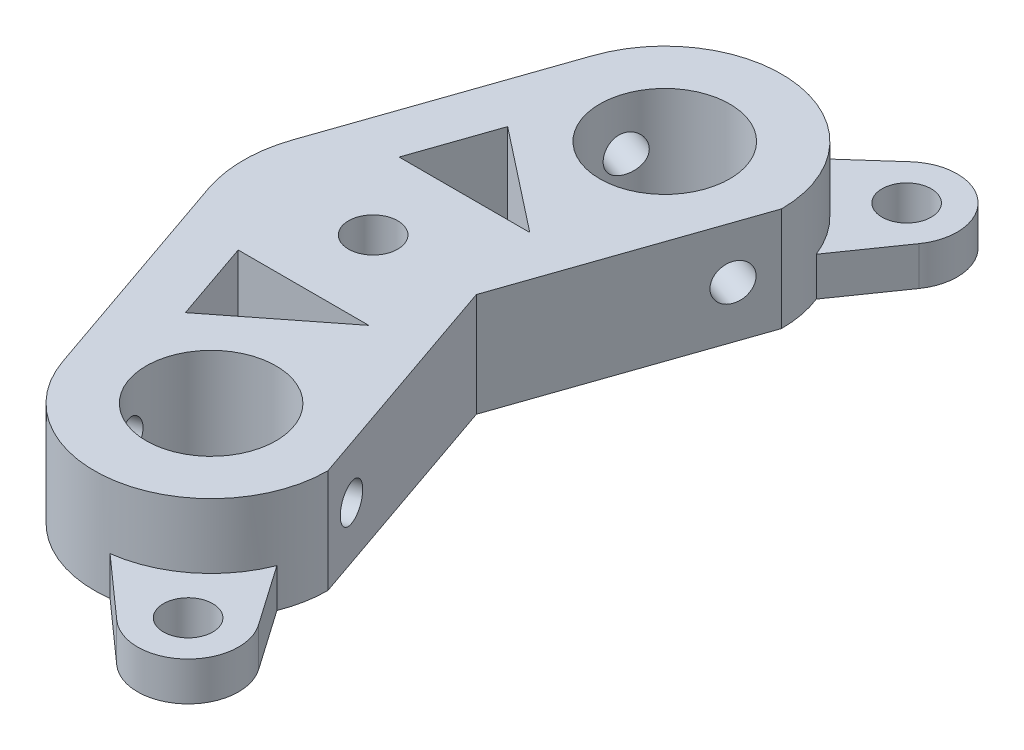
from build123d import *

# Parameters (mm, degrees)
SKETCH1_R               = 1.9
SKETCH1_R_2             = 5.01
BOSS_EXTRUDE1_DEPTH     = 8
SKETCH2_R               = 1.9
BOSS_EXTRUDE2_DEPTH     = 3
SKETCH3_R               = 1.4
CUT_EXTRUDE1_DEPTH      = 22
CUT_EXTRUDE3_DEPTH      = 8
MIRROR3_COPY_1_SKETCH_R = 1.4
MIRROR3_COPY_1_DEPTH    = 22


with BuildPart() as part:
    # Sketch1 → Boss-Extrude1 (new body)
    with BuildSketch(Plane(origin=(0, 0, 0), x_dir=(1, 0, 0), z_dir=(0, 1, 0))):
        with BuildLine():
            Line((-9.451570228, 3.266162922), (-3.515864775, 20.442812793))
            ThreePointArc((-3.515864775, 20.442812793), (6.49200509, 26.385607509), (14.01, 17.5))
            Line((14.01, 17.5), (7.962554998, 0))
            Line((7.962554998, 0), (14.01, -17.5))
            ThreePointArc((14.01, -17.5), (6.49200509, -26.385607509), (-3.515864775, -20.442812793))
            Line((-3.515864775, -20.442812793), (-9.451570228, -3.266162922))
            ThreePointArc((-9.451570228, -3.266162922), (-10, 0), (-9.451570228, 3.266162922))
        make_face()
        with Locations(Location((0, 0, 0), (0, 0, 270))):
            Circle(SKETCH1_R, mode=Mode.SUBTRACT)
        with Locations(Location((5, 17.5, 0), (0, 0, 270))):
            Circle(SKETCH1_R_2, mode=Mode.SUBTRACT)
        with Locations(Location((5, -17.5, 0), (0, 0, 270))):
            Circle(SKETCH1_R_2, mode=Mode.SUBTRACT)
    extrude(amount=BOSS_EXTRUDE1_DEPTH)

    # Sketch2 → Boss-Extrude2 (add)
    with BuildSketch(Plane(origin=(0, 0, 0), x_dir=(1, 0, 0), z_dir=(0, 1, 0))):
        with BuildLine():
            Line((13.381079467, 20.80720531), (16.642446553, 25.488071975))
            ThreePointArc((16.642446553, 25.488071975), (16.031174239, 30.634605863), (10.84846826, 30.629744064))
            Line((10.84846826, 30.629744064), (6.141997733, 26.43733412))
            Line((6.141997733, 26.43733412), (13.381079467, 20.80720531))
        make_face()
        with Locations(Location((13.442555379, 27.717577856, 0), (0, 0, 270))):
            Circle(SKETCH2_R, mode=Mode.SUBTRACT)
    boss_extrude2 = extrude(amount=BOSS_EXTRUDE2_DEPTH)

    # Sketch3 → Cut-Extrude1 (cut)
    with BuildSketch(Plane(origin=(7.113123944, 0, 2.458070049), x_dir=(0.3266162922151865, 0, -0.9451570227531528), z_dir=(0.9451570227531528, 0, 0.3266162922151865))):
        with Locations((18.173329359, 4)):
            Circle(SKETCH3_R)
    cut_extrude1 = extrude(amount=-CUT_EXTRUDE1_DEPTH, mode=Mode.SUBTRACT)

    # Mirror1: Cut-Extrude1 across plane
    add(cut_extrude1.mirror(Plane.XY), mode=Mode.SUBTRACT)

    # Sketch5 → Cut-Extrude3 (cut)
    with BuildSketch(Plane(origin=(0, 0, 0), x_dir=(1, 0, 0), z_dir=(0, 1, 0))):
        Polygon((-2.052506292, 12.430669751), (-4.202841327, 6.208064486), (5.87576418, 6.208064486), align=None)
    cut_extrude3 = extrude(amount=CUT_EXTRUDE3_DEPTH, mode=Mode.SUBTRACT)

    # Mirror3: Boss-Extrude2, Cut-Extrude1, Cut-Extrude3 across plane
    add(boss_extrude2.mirror(Plane.XY))
    add(cut_extrude1.mirror(Plane.XY), mode=Mode.SUBTRACT)
    add(cut_extrude3.mirror(Plane.XY), mode=Mode.SUBTRACT)

    # Mirror3 copy 1 sketch → Mirror3 copy 1 (cut)
    with BuildSketch(Plane(origin=(7.113123944, 0, 2.458070049), x_dir=(0.3266162922151865, 0, -0.9451570227531528), z_dir=(0.9451570227531528, 0, 0.3266162922151865))):
        with Locations((18.173329359, 4)):
            Circle(MIRROR3_COPY_1_SKETCH_R)
    extrude(amount=-MIRROR3_COPY_1_DEPTH, mode=Mode.SUBTRACT)


solid = part.part
